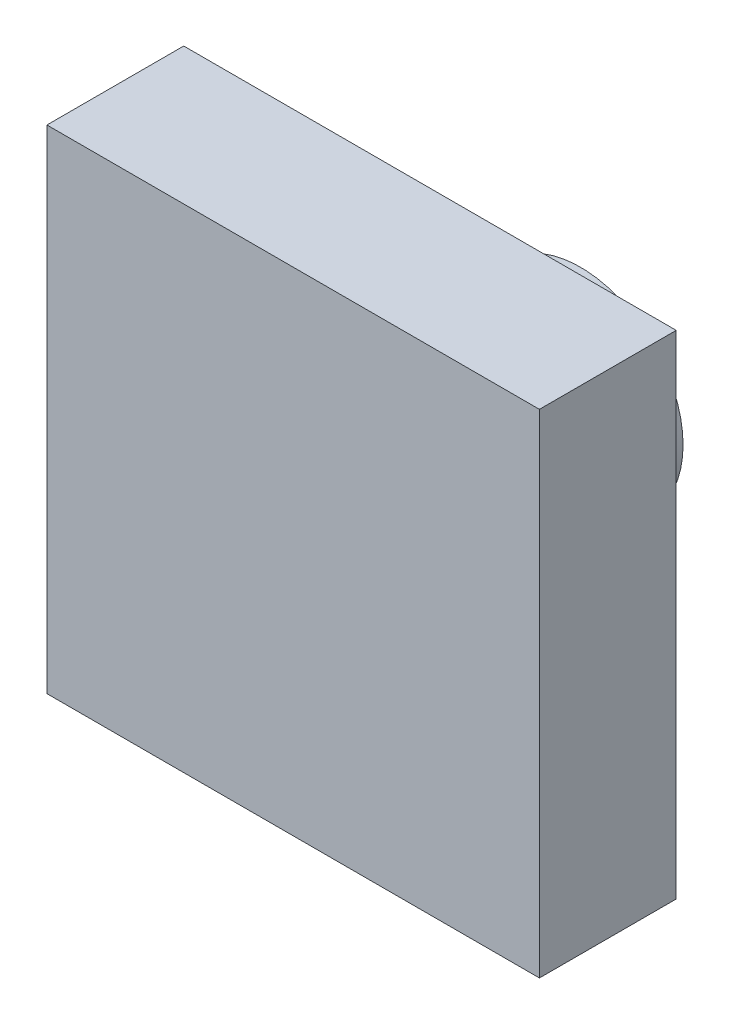
from build123d import *

# Parameters (mm, degrees)
SKETCH_1_W      = 36
SKETCH_1_H      = 36
EXTRUDE_1_DEPTH = 10
SKETCH_1_3_W    = 21.620111732
SKETCH_1_3_H    = 21.620111732
EXTRUDE_2_DEPTH = 3
SKETCH_2_R      = 7.5
EXTRUDE_3_DEPTH = 8


with BuildPart() as part:
    # 草图1 → 凸台-拉伸1 (new body)
    with BuildSketch(Plane.XY):
        Rectangle(SKETCH_1_W, SKETCH_1_H)
    extrude(amount=EXTRUDE_1_DEPTH)

    # 草图1<3> → 凸台-拉伸2 (add)
    with BuildSketch(Plane.XY):
        Rectangle(SKETCH_1_3_W, SKETCH_1_3_H)
    extrude(amount=-EXTRUDE_2_DEPTH)

    # 草图2 → 凸台-拉伸3 (add)
    with BuildSketch(Plane(origin=(0, 0, -3), x_dir=(-1, 0, 0), z_dir=(0, 0, -1))):
        Circle(SKETCH_2_R)
    extrude(amount=EXTRUDE_3_DEPTH)


solid = part.part
